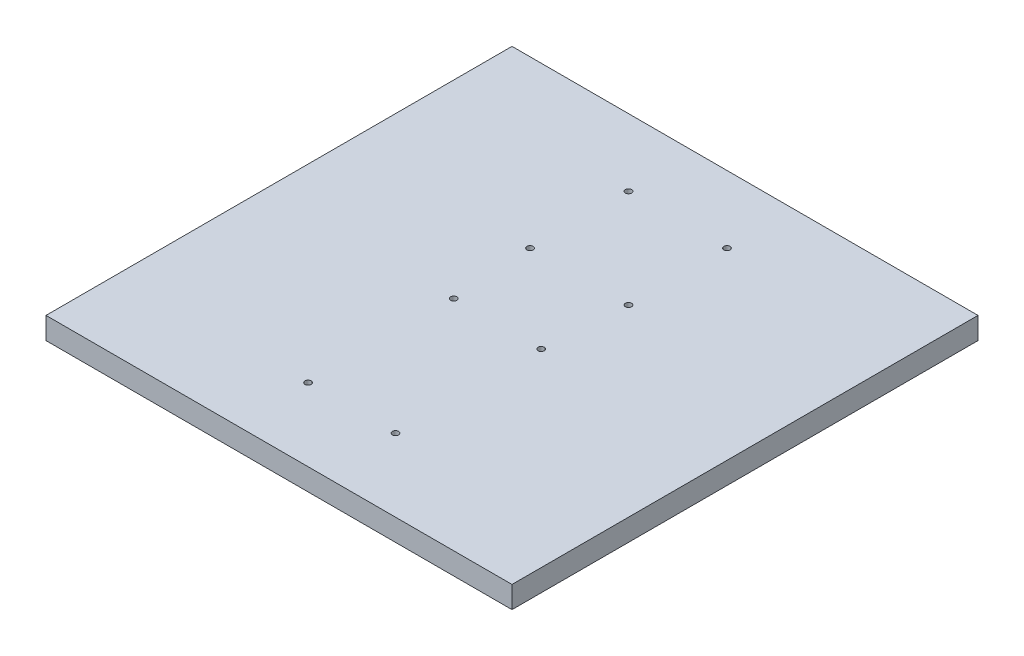
from build123d import *

# Parameters (mm, degrees)
SKETCH1_W             = 203.2
SKETCH1_H             = 203.2
BOSS_EXTRUDE1_DEPTH   = 9.525
F_6_32_TAPPED_HOLE1_D = 2.7051
F_6_32_TAPPED_HOLE2_D = 2.7051


with BuildPart() as part:
    # Sketch1 → Boss-Extrude1 (new body)
    with BuildSketch(Plane(origin=(0, 0, 0), x_dir=(1, 0, 0), z_dir=(0, 1, 0))):
        Rectangle(SKETCH1_W, SKETCH1_H)
    extrude(amount=BOSS_EXTRUDE1_DEPTH)

    # #6-32 Tapped Hole1 (through all)
    with Locations(Plane(origin=(0, 9.525, 0), x_dir=(-1, 0, 0), z_dir=(0, 1, 0))):
        with Locations((21.463, -72.263), (-21.463, -72.263), (-21.463, -29.337), (21.463, -29.337)):
            Hole(F_6_32_TAPPED_HOLE1_D / 2)

    # #6-32 Tapped Hole2 (through all)
    with Locations(Plane(origin=(0, 9.525, 0), x_dir=(-1, 0, 0), z_dir=(0, 1, 0))):
        with Locations((19.05, 6.35), (-19.05, 6.35), (-19.05, 69.85), (19.05, 69.85)):
            Hole(F_6_32_TAPPED_HOLE2_D / 2)


solid = part.part
